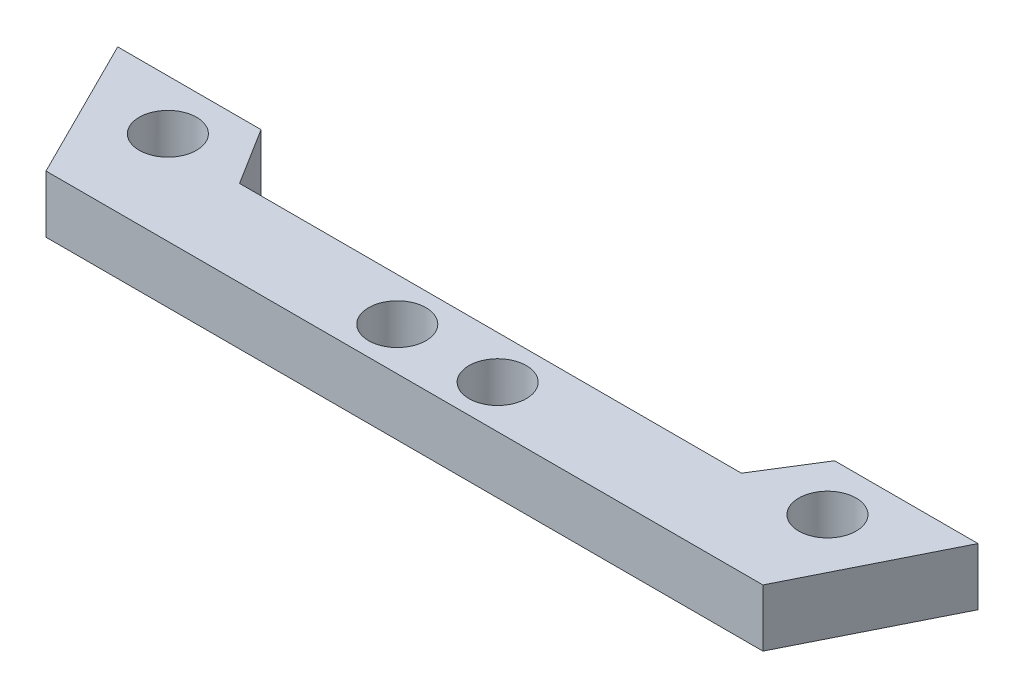
from build123d import *

# Parameters (mm, degrees)
SKETCH2_W           = 120
SKETCH2_H           = 20
BOSS_EXTRUDE1_DEPTH = 8
CUT_EXTRUDE1_DEPTH  = 40
SKETCH4_R           = 4
CUT_EXTRUDE2_DEPTH  = 10


with BuildPart() as part:
    # Sketch2 → Boss-Extrude1 (new body)
    with BuildSketch(Plane(origin=(0, 0, 0), x_dir=(1, 0, 0), z_dir=(0, 1, 0))):
        with Locations((60, 10)):
            Rectangle(SKETCH2_W, SKETCH2_H)
    extrude(amount=BOSS_EXTRUDE1_DEPTH)

    # Sketch3 → Cut-Extrude1 (cut)
    with BuildSketch(Plane(origin=(0, 8, 0), x_dir=(1, 0, 0), z_dir=(0, 1, 0))):
        Polygon((10, 0), (0, 20), (0, 0), align=None)
        Polygon((120, 0), (120, 20), (110, 0), align=None)
        Polygon((60, 12), (60, 20), (20, 20), (25, 12), align=None)
        Polygon((100, 20), (60, 20), (60, 12), (95, 12), align=None)
    extrude(amount=-CUT_EXTRUDE1_DEPTH, mode=Mode.SUBTRACT)

    # Sketch4 → Cut-Extrude2 (cut)
    with BuildSketch(Plane(origin=(0, 8, 0), x_dir=(1, 0, 0), z_dir=(0, 1, 0))):
        with Locations(Location((14, 13, 0), (0, 0, 270))):
            Circle(SKETCH4_R)
        with Locations(Location((53, 6, 0), (0, 0, 270))):
            Circle(SKETCH4_R)
        with Locations(Location((67, 6, 0), (0, 0, 270))):
            Circle(SKETCH4_R)
        with Locations(Location((106, 13, 0), (0, 0, 270))):
            Circle(SKETCH4_R)
    extrude(amount=-CUT_EXTRUDE2_DEPTH, mode=Mode.SUBTRACT)


solid = part.part
